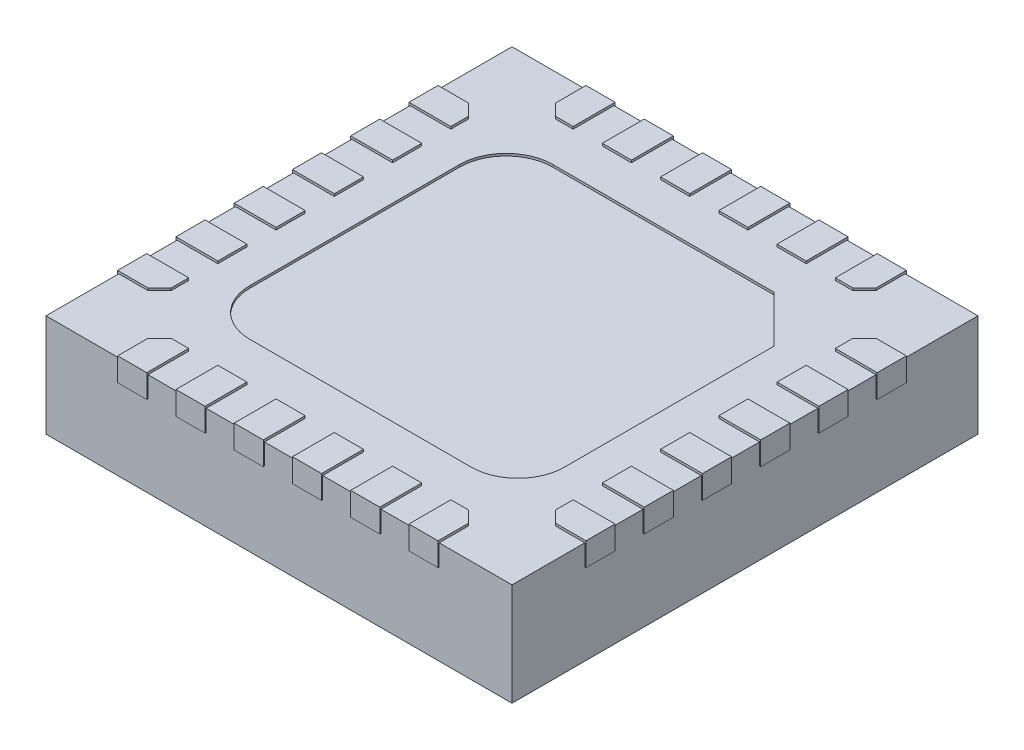
from build123d import *

# Parameters (mm, degrees)
SKETCH1_W                = 4
SKETCH1_H                = 4
BOSS_EXTRUDE1_DEPTH      = 0.88
BOSS_EXTRUDE3_DEPTH      = 0.02
BOSS_EXTRUDE3_DEPTH_BACK = 0.18
CUT_EXTRUDE1_DEPTH       = 0.02
SKETCH4_R                = 0.1
CUT_EXTRUDE2_DEPTH       = 0.02


with BuildPart() as part:
    # Sketch1 → Boss-Extrude1 (new body)
    with BuildSketch(Plane(origin=(0, 0, 0), x_dir=(1, 0, 0), z_dir=(0, 1, 0))):
        Rectangle(SKETCH1_W, SKETCH1_H)
    extrude(amount=BOSS_EXTRUDE1_DEPTH)

    # Sketch2 → Boss-Extrude3 (add, two sides: drawn at the far end of the back side and taken through both)
    with BuildSketch(Plane(origin=(0, 0.88, 0), x_dir=(1, 0, 0), z_dir=(0, 1, 0)).offset(-BOSS_EXTRUDE3_DEPTH_BACK)):
        Polygon((2, 1.375012124), (1.750012124, 1.375012124), (1.65, 1.275), (1.65, 1.124992652), (2, 1.124992652), (2.01, 1.124992652), (2.01, 1.375012124), align=None)
        Polygon((2, 0.624996326), (1.65, 0.624996326), (1.65, 0.875015798), (2, 0.875015798), (2.01, 0.875015798), (2.01, 0.624996326), align=None)
        Polygon((2, 0.125), (1.65, 0.125), (1.65, 0.375019472), (2, 0.375019472), (2.01, 0.374998163), (2.01, 0.125), align=None)
        Polygon((2, -0.374996326), (1.65, -0.374996326), (1.65, -0.124976854), (2, -0.124976854), (2.01, -0.124976854), (2.01, -0.374996326), align=None)
        Polygon((2, -0.874992652), (1.65, -0.874992652), (1.65, -0.62497318), (2, -0.62497318), (2.01, -0.62497318), (2.01, -0.874992652), align=None)
        Polygon((2, -1.374988978), (1.75, -1.374988978), (1.65, -1.274988978), (1.65, -1.124969506), (2, -1.124969506), (2.01, -1.124969506), (2.01, -1.374988978), align=None)
        Polygon((-1.375, -2), (-1.375, -2.01), (-1.125, -2.01), (-1.125, -2), (-1.125, -1.65), (-1.275, -1.65), (-1.375, -1.75), align=None)
        Polygon((-2, -1.124969506), (-1.65, -1.124969506), (-1.65, -1.275), (-1.75, -1.375), (-2, -1.374988978), (-2.01, -1.374988978), (-2.01, -1.124969506), align=None)
        Polygon((-2, -0.62497318), (-1.65, -0.62497318), (-1.65, -0.874992652), (-2, -0.874992652), (-2.01, -0.874992652), (-2.01, -0.62497318), align=None)
        Polygon((1.375, -2.01), (1.375, -2), (1.375, -1.75), (1.275, -1.65), (1.125, -1.65), (1.125, -2), (1.125, -2.01), align=None)
        Polygon((-2, -0.124976854), (-1.65, -0.124976854), (-1.65, -0.374996326), (-2, -0.374996326), (-2.01, -0.374996326), (-2.01, -0.124976854), align=None)
        Polygon((-2, 0.375019472), (-1.65, 0.375019472), (-1.65, 0.125), (-2, 0.125), (-2.01, 0.125), (-2.01, 0.374998163), align=None)
        Polygon((-2, 0.875015798), (-1.65, 0.875015798), (-1.65, 0.624996326), (-2, 0.624996326), (-2.01, 0.624996326), (-2.01, 0.875015798), align=None)
        Polygon((-1.65, 1.275), (-1.65, 1.124992652), (-2, 1.124992652), (-2.01, 1.124992652), (-2.01, 1.375012124), (-2, 1.375012124), (-1.75, 1.375), align=None)
        Polygon((1.125, 2.01), (1.125, 2), (1.125, 1.65), (1.275, 1.65), (1.375, 1.75), (1.375, 2), (1.375, 2.01), align=None)
        Polygon((-0.875, -1.65), (-0.875, -2), (-0.875, -2.01), (-0.625, -2.01), (-0.625, -2), (-0.625, -1.65), align=None)
        Polygon((-0.375, -1.65), (-0.375, -2), (-0.375, -2.01), (-0.125, -2.01), (-0.125, -2), (-0.125, -1.65), align=None)
        Polygon((0.125, -1.65), (0.125, -2), (0.125, -2.01), (0.375, -2.01), (0.375, -2), (0.375, -1.65), align=None)
        Polygon((0.625, -1.65), (0.625, -2), (0.625, -2.01), (0.875, -2.01), (0.875, -2), (0.875, -1.65), align=None)
        Polygon((0.875, 1.65), (0.875, 2), (0.875, 2.01), (0.625, 2.01), (0.625, 2), (0.625, 1.65), align=None)
        Polygon((0.375, 1.65), (0.375, 2), (0.375, 2.01), (0.125, 2.01), (0.125, 2), (0.125, 1.65), align=None)
        Polygon((-0.125, 1.65), (-0.125, 2), (-0.125, 2.01), (-0.375, 2.01), (-0.375, 2), (-0.375, 1.65), align=None)
        Polygon((-0.625, 1.65), (-0.625, 2), (-0.625, 2.01), (-0.875, 2.01), (-0.875, 2), (-0.875, 1.65), align=None)
        Polygon((-1.125, 1.65), (-1.125, 2), (-1.125, 2.01), (-1.375, 2.01), (-1.375, 2), (-1.375, 1.75), (-1.275, 1.65), align=None)
    extrude(amount=BOSS_EXTRUDE3_DEPTH + BOSS_EXTRUDE3_DEPTH_BACK)

    # Sketch3 → Cut-Extrude1 (cut)
    with BuildSketch(Plane(origin=(0, 0.88, 0), x_dir=(1, 0, 0), z_dir=(0, 1, 0))):
        with BuildLine():
            Line((0.95, 1.3), (1.35, 0.9))
            Line((1.35, 0.9), (1.35, -0.9))
            ThreePointArc((1.35, -0.9), (1.232842712, -1.182842712), (0.95, -1.3))
            Line((0.95, -1.3), (-0.95, -1.3))
            ThreePointArc((-0.95, -1.3), (-1.232842712, -1.182842712), (-1.35, -0.9))
            Line((-1.35, -0.9), (-1.35, 0.9))
            ThreePointArc((-1.35, 0.9), (-1.232842712, 1.182842712), (-0.95, 1.3))
            Line((-0.95, 1.3), (0.95, 1.3))
        make_face()
    extrude(amount=-CUT_EXTRUDE1_DEPTH, mode=Mode.SUBTRACT)

    # Sketch4 → Cut-Extrude2 (cut)
    with BuildSketch(Plane.XZ):
        with Locations(Location((1.5, -1.5, 0), (0, 0, 270))):
            Circle(SKETCH4_R)
    extrude(amount=-CUT_EXTRUDE2_DEPTH, mode=Mode.SUBTRACT)


solid = part.part
